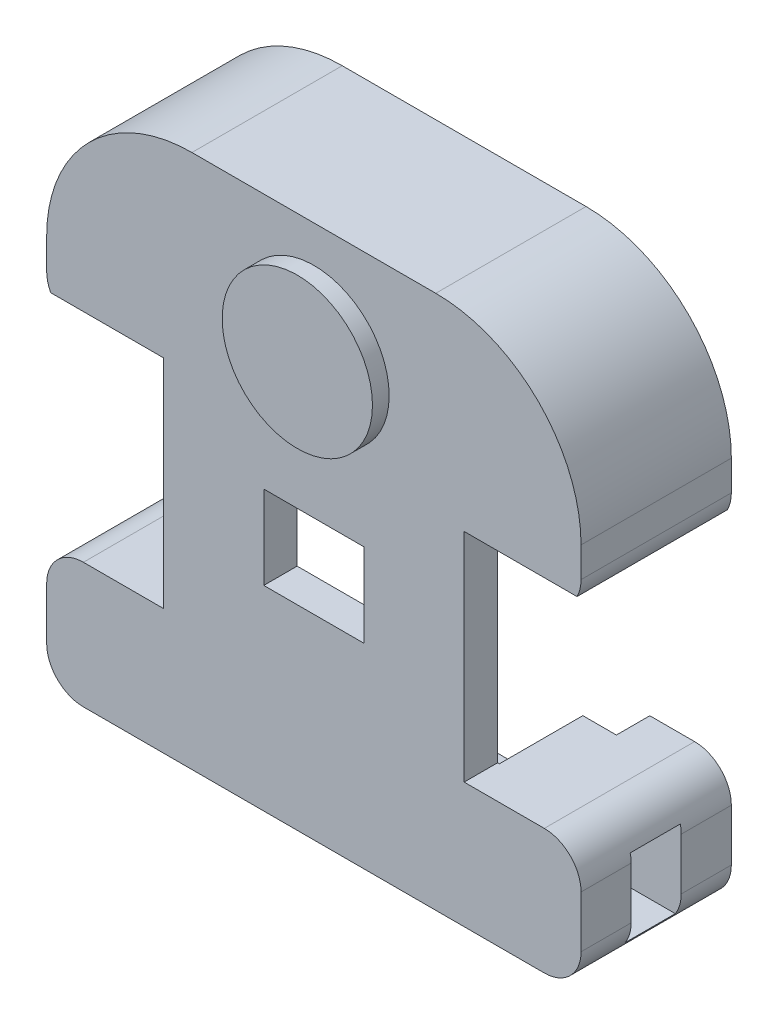
from build123d import *

# Parameters (mm, degrees)
BOSS_EXTRUDE1_DEPTH      = 17.78
CUT_EXTRUDE1_DEPTH       = 12.7
BOSS_EXTRUDE2_DEPTH      = 5.08
BOSS_EXTRUDE2_DEPTH_BACK = 17.78
CUT_EXTRUDE2_REACH       = 93.511
SKETCH8_W                = 23.622
SKETCH8_H                = 33.02
CUT_EXTRUDE3_REACH       = 116.975
SKETCH9_W                = 7.62
SKETCH9_H                = 12.192
SKETCH10_W               = 15.24
SKETCH10_H               = 12.7
CUT_EXTRUDE4_DEPTH       = 5.08
SKETCH11_R               = 11.43
BOSS_EXTRUDE3_DEPTH      = 2.54


with BuildPart() as part:
    # Sketch1 → Boss-Extrude1 (new body)
    with BuildSketch(Plane.XY.offset(2.54)):
        with BuildLine():
            Line((-35.052, 0), (35.052, 0))
            ThreePointArc((35.052, 0), (37.207261469, 0.892738531), (38.1, 3.048))
            Line((38.1, 3.048), (38.1, 10.922))
            ThreePointArc((38.1, 10.922), (37.207261469, 13.077261469), (35.052, 13.97))
            Line((35.052, 13.97), (31.242, 13.97))
            ThreePointArc((31.242, 13.97), (29.086738531, 14.862738531), (28.194, 17.018))
            Line((28.194, 17.018), (28.194, 45.974))
            ThreePointArc((28.194, 45.974), (29.086738531, 48.129261469), (31.242, 49.022))
            Line((31.242, 49.022), (35.052, 49.022))
            ThreePointArc((35.052, 49.022), (37.207261469, 49.914738531), (38.1, 52.07))
            Line((38.1, 52.07), (38.1, 56.642))
            ThreePointArc((38.1, 56.642), (32.371594426, 70.471594426), (18.542, 76.2))
            Line((18.542, 76.2), (-18.542, 76.2))
            ThreePointArc((-18.542, 76.2), (-32.371594426, 70.471594426), (-38.1, 56.642))
            Line((-38.1, 56.642), (-38.1, 52.07))
            ThreePointArc((-38.1, 52.07), (-37.207261469, 49.914738531), (-35.052, 49.022))
            Line((-35.052, 49.022), (-31.242, 49.022))
            ThreePointArc((-31.242, 49.022), (-29.086738531, 48.129261469), (-28.194, 45.974))
            Line((-28.194, 45.974), (-28.194, 17.018))
            ThreePointArc((-28.194, 17.018), (-29.086738531, 14.862738531), (-31.242, 13.97))
            Line((-31.242, 13.97), (-35.052, 13.97))
            ThreePointArc((-35.052, 13.97), (-37.207261469, 13.077261469), (-38.1, 10.922))
            Line((-38.1, 10.922), (-38.1, 3.048))
            ThreePointArc((-38.1, 3.048), (-37.207261469, 0.892738531), (-35.052, 0))
        make_face()
    extrude(amount=-BOSS_EXTRUDE1_DEPTH)

    # Sketch2 → Cut-Extrude1 (cut)
    with BuildSketch(Plane(origin=(0, 0, -15.24), x_dir=(-1, 0, 0), z_dir=(0, 0, -1))):
        with BuildLine():
            Line((33.02, 54.102), (33.02, 56.642))
            ThreePointArc((33.02, 56.642), (28.779491978, 66.879491978), (18.542, 71.12))
            Line((18.542, 71.12), (-18.542, 71.12))
            ThreePointArc((-18.542, 71.12), (-28.779491978, 66.879491978), (-33.02, 56.642))
            Line((-33.02, 56.642), (-33.02, 54.102))
            Line((-33.02, 54.102), (-31.242, 54.102))
            ThreePointArc((-31.242, 54.102), (-25.494636083, 51.721363917), (-23.114, 45.974))
            Line((-23.114, 45.974), (-23.114, 17.018))
            ThreePointArc((-23.114, 17.018), (-25.494636083, 11.270636083), (-31.242, 8.89))
            Line((-31.242, 8.89), (-33.02, 8.89))
            Line((-33.02, 8.89), (-33.02, 5.08))
            Line((-33.02, 5.08), (33.02, 5.08))
            Line((33.02, 5.08), (33.02, 8.89))
            Line((33.02, 8.89), (31.242, 8.89))
            ThreePointArc((31.242, 8.89), (25.494636083, 11.270636083), (23.114, 17.018))
            Line((23.114, 17.018), (23.114, 45.974))
            ThreePointArc((23.114, 45.974), (25.494636083, 51.721363917), (31.242, 54.102))
            Line((31.242, 54.102), (33.02, 54.102))
        make_face()
    extrude(amount=-CUT_EXTRUDE1_DEPTH, mode=Mode.SUBTRACT)

    # Sketch7 → Boss-Extrude2 (add, two sides: drawn at the far end of the back side and taken through both)
    with BuildSketch(Plane(origin=(0, 0, -15.24), x_dir=(-1, 0, 0), z_dir=(0, 0, -1)).offset(-BOSS_EXTRUDE2_DEPTH_BACK)):
        with BuildLine():
            Line((18.542, 78.74), (-18.542, 78.74))
            ThreePointArc((-18.542, 78.74), (-34.167645651, 72.267645651), (-40.64, 56.642))
            Line((-40.64, 56.642), (-40.64, 52.07))
            ThreePointArc((-40.64, 52.07), (-39.003312693, 48.118687307), (-35.052, 46.482))
            Line((-35.052, 46.482), (-31.242, 46.482))
            ThreePointArc((-31.242, 46.482), (-30.882789755, 46.333210245), (-30.734, 45.974))
            Line((-30.734, 45.974), (-30.734, 17.018))
            ThreePointArc((-30.734, 17.018), (-30.882789755, 16.658789755), (-31.242, 16.51))
            Line((-31.242, 16.51), (-35.052, 16.51))
            ThreePointArc((-35.052, 16.51), (-39.003312693, 14.873312693), (-40.64, 10.922))
            Line((-40.64, 10.922), (-40.64, 3.048))
            ThreePointArc((-40.64, 3.048), (-39.003312693, -0.903312693), (-35.052, -2.54))
            Line((-35.052, -2.54), (35.052, -2.54))
            ThreePointArc((35.052, -2.54), (39.003312693, -0.903312693), (40.64, 3.048))
            Line((40.64, 3.048), (40.64, 10.922))
            ThreePointArc((40.64, 10.922), (39.003312693, 14.873312693), (35.052, 16.51))
            Line((35.052, 16.51), (31.242, 16.51))
            ThreePointArc((31.242, 16.51), (30.882789755, 16.658789755), (30.734, 17.018))
            Line((30.734, 17.018), (30.734, 45.974))
            ThreePointArc((30.734, 45.974), (30.882789755, 46.333210245), (31.242, 46.482))
            Line((31.242, 46.482), (35.052, 46.482))
            ThreePointArc((35.052, 46.482), (39.003312693, 48.118687307), (40.64, 52.07))
            Line((40.64, 52.07), (40.64, 56.642))
            ThreePointArc((40.64, 56.642), (34.167645651, 72.267645651), (18.542, 78.74))
        make_face()
        with BuildLine():
            ThreePointArc((-38.1, 52.07), (-37.207261469, 49.914738531), (-35.052, 49.022))
            Line((-35.052, 49.022), (-31.242, 49.022))
            ThreePointArc((-31.242, 49.022), (-29.086738531, 48.129261469), (-28.194, 45.974))
            Line((-28.194, 45.974), (-28.194, 17.018))
            ThreePointArc((-28.194, 17.018), (-29.086738531, 14.862738531), (-31.242, 13.97))
            Line((-31.242, 13.97), (-35.052, 13.97))
            ThreePointArc((-35.052, 13.97), (-37.207261469, 13.077261469), (-38.1, 10.922))
            Line((-38.1, 10.922), (-38.1, 3.048))
            ThreePointArc((-38.1, 3.048), (-37.207261469, 0.892738531), (-35.052, 0))
            Line((-35.052, 0), (35.052, 0))
            ThreePointArc((35.052, 0), (37.207261469, 0.892738531), (38.1, 3.048))
            Line((38.1, 3.048), (38.1, 10.922))
            ThreePointArc((38.1, 10.922), (37.207261469, 13.077261469), (35.052, 13.97))
            Line((35.052, 13.97), (31.242, 13.97))
            ThreePointArc((31.242, 13.97), (29.086738531, 14.862738531), (28.194, 17.018))
            Line((28.194, 17.018), (28.194, 45.974))
            ThreePointArc((28.194, 45.974), (29.086738531, 48.129261469), (31.242, 49.022))
            Line((31.242, 49.022), (35.052, 49.022))
            ThreePointArc((35.052, 49.022), (37.207261469, 49.914738531), (38.1, 52.07))
            Line((38.1, 52.07), (38.1, 56.642))
            ThreePointArc((38.1, 56.642), (32.371594426, 70.471594426), (18.542, 76.2))
            Line((18.542, 76.2), (-18.542, 76.2))
            ThreePointArc((-18.542, 76.2), (-32.371594426, 70.471594426), (-38.1, 56.642))
            Line((-38.1, 56.642), (-38.1, 52.07))
        make_face(mode=Mode.SUBTRACT)
    extrude(amount=BOSS_EXTRUDE2_DEPTH + BOSS_EXTRUDE2_DEPTH_BACK)

    # Cut-Extrude2: up to this face of the body (flat: up to its plane)
    cut_extrude2_end = Plane(part.part.faces().sort_by_distance((0, 37.604047464, 2.54))[0])
    # Sketch8 → Cut-Extrude2 (cut, up to the picked face)
    with BuildSketch(Plane(origin=(0, 0, -20.32), x_dir=(-1, 0, 0), z_dir=(0, 0, -1)), mode=Mode.PRIVATE) as cut_extrude2_sk1:
        with Locations((-34.671, 33.02)):
            Rectangle(SKETCH8_W, SKETCH8_H)
    cut_extrude2_tool1 = split(extrude(cut_extrude2_sk1.sketch, amount=-CUT_EXTRUDE2_REACH, mode=Mode.PRIVATE), bisect_by=cut_extrude2_end, keep=Keep.BOTH, mode=Mode.PRIVATE)
    # Sketch8 → Cut-Extrude2 (cut, up to the picked face)
    with BuildSketch(Plane(origin=(0, 0, -20.32), x_dir=(-1, 0, 0), z_dir=(0, 0, -1)), mode=Mode.PRIVATE) as cut_extrude2_sk2:
        with Locations((34.671, 33.02)):
            Rectangle(SKETCH8_W, SKETCH8_H)
    cut_extrude2_tool2 = split(extrude(cut_extrude2_sk2.sketch, amount=-CUT_EXTRUDE2_REACH, mode=Mode.PRIVATE), bisect_by=cut_extrude2_end, keep=Keep.BOTH, mode=Mode.PRIVATE)
    add(cut_extrude2_tool1.solids().sort_by(Axis((34.671, 33.02, -20.32), (0, 0, 1)))[0], mode=Mode.SUBTRACT)
    add(cut_extrude2_tool2.solids().sort_by(Axis((-34.671, 33.02, -20.32), (0, 0, 1)))[0], mode=Mode.SUBTRACT)

    # Cut-Extrude3: up to this face of the body (flat: up to its plane)
    cut_extrude3_end = Plane(part.part.faces().sort_by_distance((40.64, 6.985, -8.89))[0])
    # Sketch9 → Cut-Extrude3 (cut, up to the picked face)
    with BuildSketch(Plane.ZY.offset(40.64), mode=Mode.PRIVATE) as cut_extrude3_sk1:
        with Locations((-8.89, 6.096)):
            Rectangle(SKETCH9_W, SKETCH9_H)
    cut_extrude3_tool1 = split(extrude(cut_extrude3_sk1.sketch, amount=-CUT_EXTRUDE3_REACH, mode=Mode.PRIVATE), bisect_by=cut_extrude3_end, keep=Keep.BOTH, mode=Mode.PRIVATE)
    add(cut_extrude3_tool1.solids().sort_by(Axis((-40.64, 6.096, -8.89), (1, 0, 0)))[0], mode=Mode.SUBTRACT)

    # Sketch10 → Cut-Extrude4 (cut)
    with BuildSketch(Plane.XY.offset(2.54)):
        with Locations((0, 33.528)):
            Rectangle(SKETCH10_W, SKETCH10_H)
    extrude(amount=-CUT_EXTRUDE4_DEPTH, mode=Mode.SUBTRACT)

    # Sketch11 → Boss-Extrude3 (add)
    with BuildSketch(Plane.XY.offset(2.54)):
        with Locations((0.024363157, 61.722)):
            Circle(SKETCH11_R)
    extrude(amount=BOSS_EXTRUDE3_DEPTH)


solid = part.part
